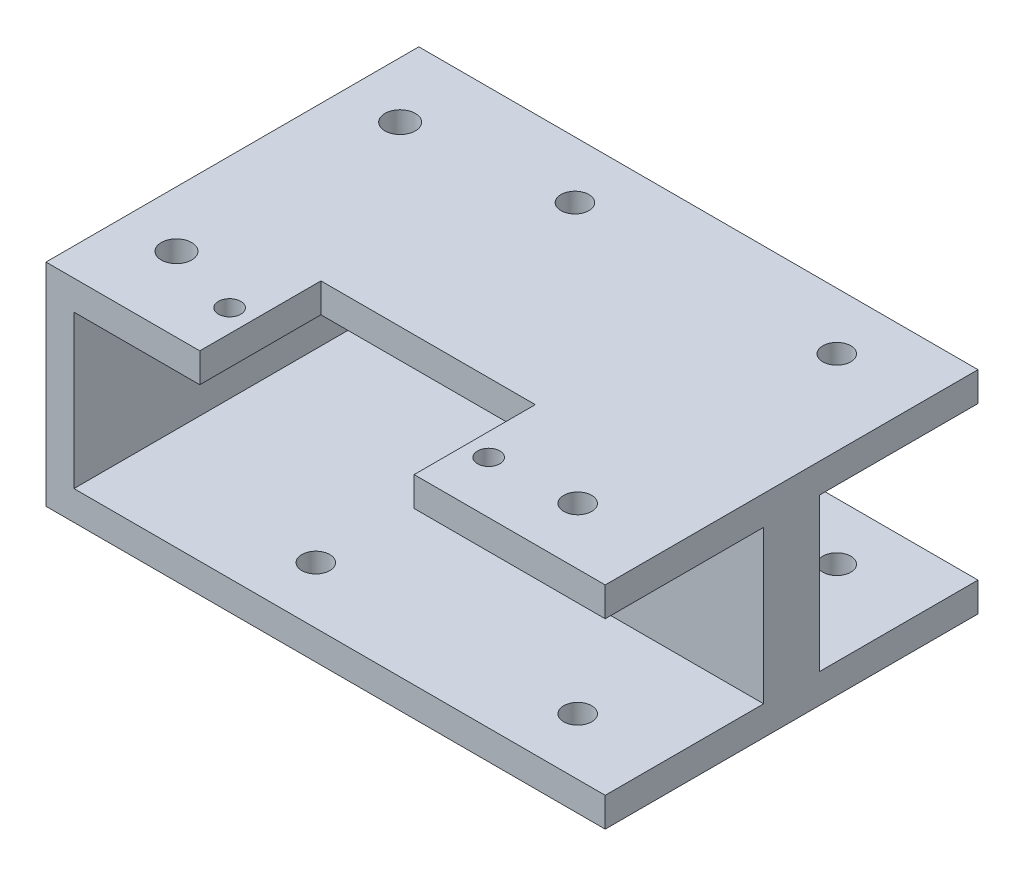
from build123d import *

# Parameters (mm, degrees)
SKETCH1_W                 = 60
SKETCH1_H                 = 40
BOSS_EXTRUDE1_DEPTH       = 3.15
BOSS_EXTRUDE2_START       = 16.4
SKETCH1_2_W               = 60
SKETCH1_2_H               = 40
BOSS_EXTRUDE2_DEPTH       = 3.15
SKETCH2_W                 = 3
SKETCH2_H                 = 40
SKETCH2_W_2               = 20
SKETCH2_H_2               = 6
BOSS_EXTRUDE3_DEPTH       = 16.4
M2_CLEARANCE_HOLE1_D      = 2.4
M2_CLEARANCE_HOLE1_DEPTH  = 5
M2_CLEARANCE_HOLE1_TIP    = 0.721032743
F_3_0MM_DOWEL_HOLE1_D     = 3
SKETCH5_W                 = 23
SKETCH5_H                 = 13
CUT_EXTRUDE1_DEPTH        = 7
F_4_CLEARANCE_HOLE2_D     = 3.2639
F_4_CLEARANCE_HOLE2_DEPTH = 10
F_4_CLEARANCE_HOLE2_TIP   = 0.980574487


with BuildPart() as part:
    # Sketch1 → Boss-Extrude1 (new body)
    with BuildSketch(Plane(origin=(0, 0, 0), x_dir=(1, 0, 0), z_dir=(0, 1, 0))):
        with Locations((30, 0)):
            Rectangle(SKETCH1_W, SKETCH1_H)
    extrude(amount=-BOSS_EXTRUDE1_DEPTH)



with BuildPart() as body_2:
    # Sketch1<2> → Boss-Extrude2 (new body)
    with BuildSketch(Plane(origin=(0, 0, 0), x_dir=(1, 0, 0), z_dir=(0, 1, 0)).offset(BOSS_EXTRUDE2_START)):
        with Locations((30, 0)):
            Rectangle(SKETCH1_2_W, SKETCH1_2_H)
    extrude(amount=BOSS_EXTRUDE2_DEPTH)


with BuildPart() as part_1:
    add(part.part)

    add(body_2.part)  # Boss-Extrude3 merges body 2
    # Sketch2 → Boss-Extrude3 (add)
    with BuildSketch(Plane(origin=(0, 0, 0), x_dir=(1, 0, 0), z_dir=(0, 1, 0))):
        with Locations((1.5, 0)):
            Rectangle(SKETCH2_W, SKETCH2_H)
        with Locations((50, 0)):
            Rectangle(SKETCH2_W_2, SKETCH2_H_2)
    extrude(amount=BOSS_EXTRUDE3_DEPTH)

    # M2 Clearance Hole1
    with Locations(Plane(origin=(0, 19.55, 0), x_dir=(1, 0, 0), z_dir=(0, 1, 0))):
        with Locations((14.1, -14.4), (41.9, -14.4)):
            Hole(M2_CLEARANCE_HOLE1_D / 2, depth=M2_CLEARANCE_HOLE1_DEPTH)
            with Locations((0, 0, -(M2_CLEARANCE_HOLE1_DEPTH + M2_CLEARANCE_HOLE1_TIP / 2))):  # 118° drill point
                Cone(0, M2_CLEARANCE_HOLE1_D / 2, M2_CLEARANCE_HOLE1_TIP, mode=Mode.SUBTRACT)

    # Ø3.0mm Dowel Hole1 (through all)
    with Locations(Plane(origin=(0, 19.55, 0), x_dir=(1, 0, 0), z_dir=(0, 1, 0))):
        with Locations((50.95, -13.9), (22.85, 13.9), (50.95, 13.9), (22.85, -13.9)):
            Hole(F_3_0MM_DOWEL_HOLE1_D / 2)

    # Sketch5 → Cut-Extrude1 (cut)
    with BuildSketch(Plane(origin=(0, 19.55, 0), x_dir=(1, 0, 0), z_dir=(0, 1, 0))):
        with Locations((28, -13.5)):
            Rectangle(SKETCH5_W, SKETCH5_H)
    extrude(amount=-CUT_EXTRUDE1_DEPTH, mode=Mode.SUBTRACT)

    # #4 Clearance Hole2
    with Locations(Plane(origin=(0, 19.55, 0), x_dir=(1, 0, 0), z_dir=(0, 1, 0))):
        with Locations((6, 12), (6, -12)):
            Hole(F_4_CLEARANCE_HOLE2_D / 2, depth=F_4_CLEARANCE_HOLE2_DEPTH)
            with Locations((0, 0, -(F_4_CLEARANCE_HOLE2_DEPTH + F_4_CLEARANCE_HOLE2_TIP / 2))):  # 118° drill point
                Cone(0, F_4_CLEARANCE_HOLE2_D / 2, F_4_CLEARANCE_HOLE2_TIP, mode=Mode.SUBTRACT)


solid = part_1.part
